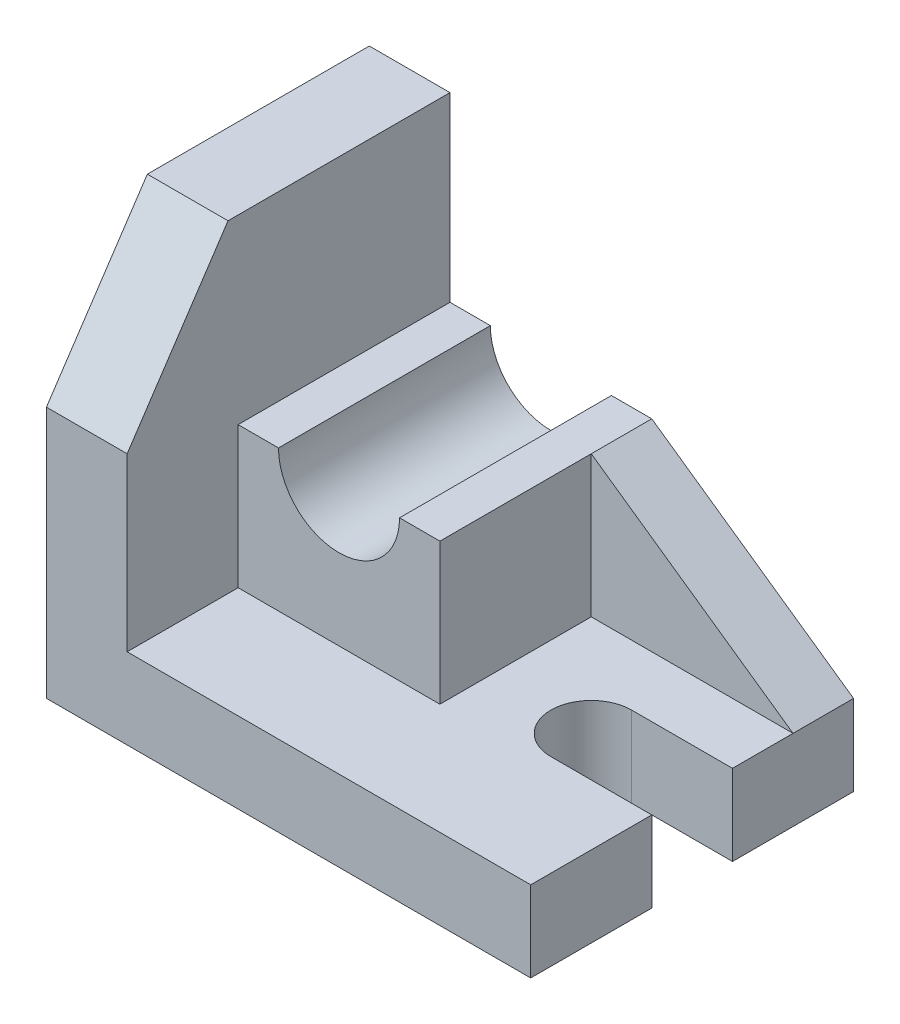
from build123d import *

# Parameters (mm, degrees)
SKETCH1_W           = 96
SKETCH1_H           = 64
BOSS_EXTRUDE1_DEPTH = 16
CUT_EXTRUDE1_DEPTH  = 16
BOSS_EXTRUDE2_DEPTH = 16
CHAMFER1_SIZE       = 20
CHAMFER1_SIZE2      = 30
SKETCH5_W           = 40
SKETCH5_H           = 28
BOSS_EXTRUDE3_DEPTH = 42
SKETCH6_R           = 12
CUT_EXTRUDE2_DEPTH  = 42
BOSS_EXTRUDE4_DEPTH = 12


with BuildPart() as part:
    # Sketch1 → Boss-Extrude1 (new body)
    with BuildSketch(Plane(origin=(0, 0, 0), x_dir=(1, 0, 0), z_dir=(0, 1, 0))):
        with Locations((-25.220534577, -0.638984057)):
            Rectangle(SKETCH1_W, SKETCH1_H)
    extrude(amount=BOSS_EXTRUDE1_DEPTH)

    # Sketch2 → Cut-Extrude1 (cut)
    with BuildSketch(Plane(origin=(0, 16, 0), x_dir=(1, 0, 0), z_dir=(0, 1, 0))):
        with BuildLine():
            Line((22.779465423, -8.638984057), (2.779465423, -8.638984057))
            ThreePointArc((2.779465423, -8.638984057), (-5.220534577, -0.638984057), (2.779465423, 7.361015943))
            Line((2.779465423, 7.361015943), (22.779465423, 7.361015943))
            ThreePointArc((22.779465423, 7.361015943), (30.779465423, -0.638984057), (22.779465423, -8.638984057))
        make_face()
    extrude(amount=-CUT_EXTRUDE1_DEPTH, mode=Mode.SUBTRACT)

    # Sketch3 → Boss-Extrude2 (add)
    with BuildSketch(Plane.ZY.offset(73.220534577)):
        Polygon((32.638984057, 16), (32.638984057, 80), (-31.362039682, 80), (-31.361015943, 16), align=None)
    extrude(amount=-BOSS_EXTRUDE2_DEPTH)

    # Chamfer1
    chamfer1_edges = [part.edges().sort_by_distance(p)[0] for p in [
        (-65.220534577, 80, 32.638984057),
    ]]
    chamfer1_side = [part.faces().sort_by_distance(p)[0] for p in [
        (-65.220534577, 80, 0.638472187),
    ]]
    chamfer(chamfer1_edges, length=CHAMFER1_SIZE, length2=CHAMFER1_SIZE2, reference=chamfer1_side[0])

    # Sketch5 → Boss-Extrude3 (add)
    with BuildSketch(Plane(origin=(0, 0, -31.361015943), x_dir=(-1, 0, 0), z_dir=(0, 0, -1))):
        with Locations((37.220534577, 30)):
            Rectangle(SKETCH5_W, SKETCH5_H)
    extrude(amount=-BOSS_EXTRUDE3_DEPTH)

    # Sketch6 → Cut-Extrude2 (cut)
    with BuildSketch(Plane.XY.offset(10.638984057)):
        with Locations((-37.220534577, 44)):
            Circle(SKETCH6_R)
    extrude(amount=-CUT_EXTRUDE2_DEPTH, mode=Mode.SUBTRACT)

    # Sketch7 → Boss-Extrude4 (add)
    with BuildSketch(Plane(origin=(0, 0, -31.361015943), x_dir=(-1, 0, 0), z_dir=(0, 0, -1))):
        Polygon((-22.779465423, 16), (17.220534577, 44), (17.220534577, 16), align=None)
    extrude(amount=-BOSS_EXTRUDE4_DEPTH)


solid = part.part
